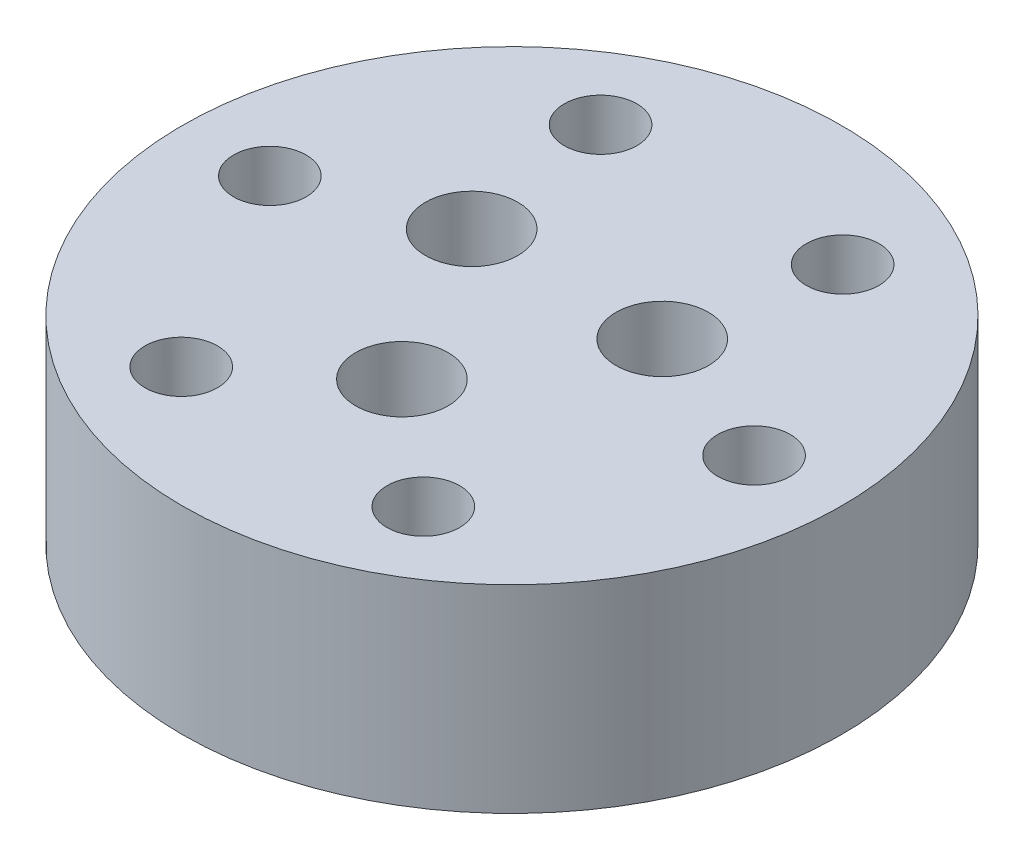
from build123d import *

# Parameters (mm, degrees)
SKETCH_1_R          = 14.975
EXTRUDE_1_DEPTH     = 9
SKETCH_2_R          = 1.65
CUT_EXTRUDE_1_DEPTH = 10
SKETCH_3_R          = 2.1
CUT_EXTRUDE_2_DEPTH = 24.010894159
SKETCH_4_R          = 3.65
CUT_EXTRUDE_3_DEPTH = 4


with BuildPart() as part:
    # 草图1 → 凸台-拉伸1 (new body)
    with BuildSketch(Plane(origin=(0, 0, 0), x_dir=(1, 0, 0), z_dir=(0, 1, 0))):
        with Locations(Location((0, 0, 0), (0, 0, 270))):
            Circle(SKETCH_1_R)
    extrude(amount=EXTRUDE_1_DEPTH)

    # 草图2 → 切除-拉伸1 (cut)
    with BuildSketch(Plane.XZ):
        with Locations(Location((-11, 0, 0), (0, 0, 270))):
            Circle(SKETCH_2_R)
        with Locations(Location((-5.5, 9.526279442, 0), (0, 0, 270))):
            Circle(SKETCH_2_R)
        with Locations(Location((5.5, 9.526279442, 0), (0, 0, 270))):
            Circle(SKETCH_2_R)
        with Locations(Location((11, 0, 0), (0, 0, 270))):
            Circle(SKETCH_2_R)
        with Locations(Location((5.5, -9.526279442, 0), (0, 0, 270))):
            Circle(SKETCH_2_R)
        with Locations(Location((-5.5, -9.526279442, 0), (0, 0, 270))):
            Circle(SKETCH_2_R)
    extrude(amount=-CUT_EXTRUDE_1_DEPTH, mode=Mode.SUBTRACT)

    # 草图3 → 切除-拉伸2 (cut, through all)
    with BuildSketch(Plane.XZ):
        with Locations(Location((0, 5, 0), (0, 0, 270))):
            Circle(SKETCH_3_R)
        with Locations(Location((4.330127019, -2.5, 0), (0, 0, 270))):
            Circle(SKETCH_3_R)
        with Locations(Location((-4.330127019, -2.5, 0), (0, 0, 270))):
            Circle(SKETCH_3_R)
    extrude(amount=-CUT_EXTRUDE_2_DEPTH, mode=Mode.SUBTRACT)

    # 草图4 → 切除-拉伸3 (cut)
    with BuildSketch(Plane.XZ):
        with Locations(Location((0, 5, 0), (0, 0, 270))):
            Circle(SKETCH_4_R)
        with Locations(Location((-4.330127019, -2.5, 0), (0, 0, 270))):
            Circle(SKETCH_4_R)
        with Locations(Location((4.330127019, -2.5, 0), (0, 0, 270))):
            Circle(SKETCH_4_R)
    extrude(amount=-CUT_EXTRUDE_3_DEPTH, mode=Mode.SUBTRACT)


solid = part.part
